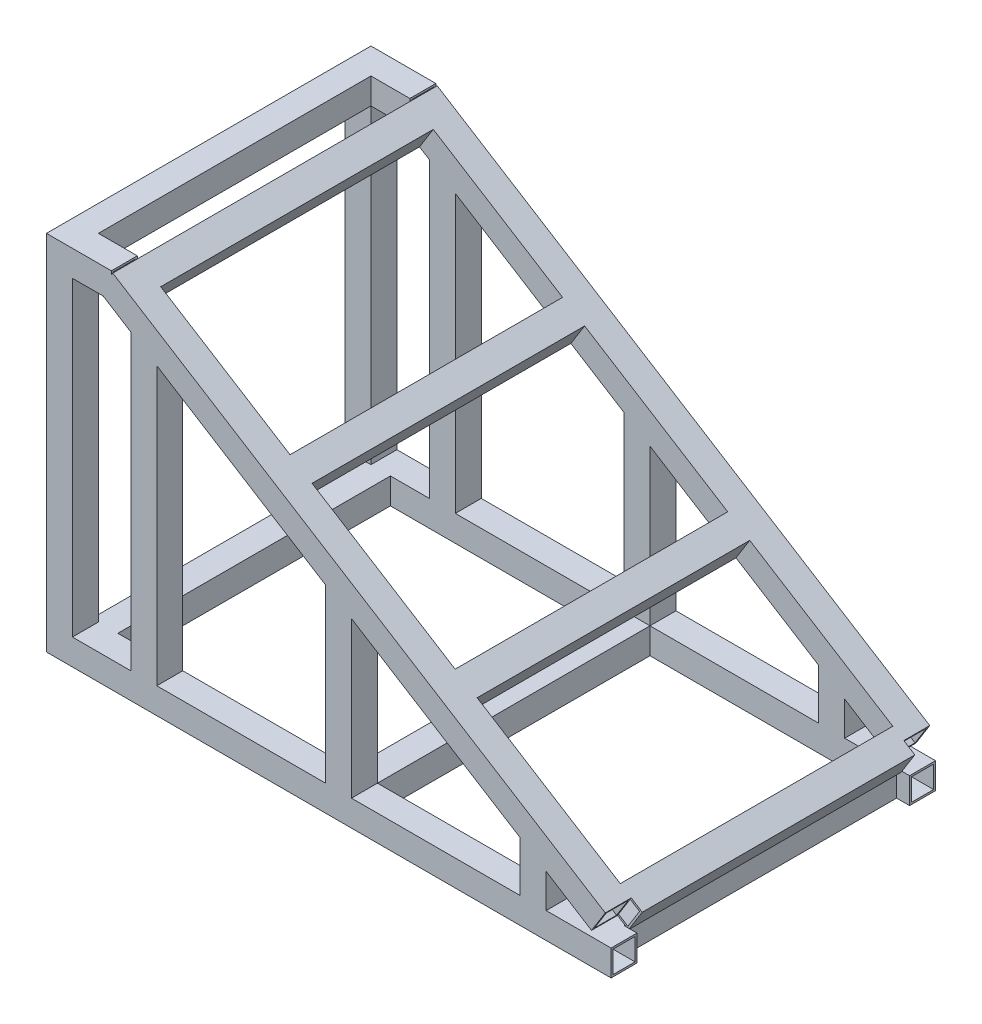
from build123d import *

# Parameters (mm, degrees)
SKETCH_1_W                      = 870
SKETCH_1_H                      = 40
L_BASE_870_SKIN_A_DEPTH         = 3
L_BASE_870_EDGE_WALLS_START     = 3
SKETCH_2_W                      = 870
SKETCH_2_H                      = 3
L_BASE_870_EDGE_WALLS_DEPTH     = 34
L_BASE_870_SKIN_B_START         = 37
SKETCH_3_W                      = 870
SKETCH_3_H                      = 40
L_BASE_870_SKIN_B_DEPTH         = 3
L_INCLINED_895_SKIN_A_DEPTH     = 3
L_INCLINED_895_EDGE_WALLS_START = 3
L_INCLINED_895_EDGE_WALLS_DEPTH = 34
L_INCLINED_895_SKIN_B_START     = 37
L_INCLINED_895_SKIN_B_DEPTH     = 3
SKETCH_7_W                      = 100
SKETCH_7_H                      = 40
L_PLATFORM_100_SKIN_A_DEPTH     = 3
L_PLATFORM_100_EDGE_WALLS_START = 3
SKETCH_8_W                      = 100
SKETCH_8_H                      = 3
L_PLATFORM_100_EDGE_WALLS_DEPTH = 34
L_PLATFORM_100_SKIN_B_START     = 37
SKETCH_9_W                      = 100
SKETCH_9_H                      = 40
L_PLATFORM_100_SKIN_B_DEPTH     = 3
SKETCH_10_W                     = 40
SKETCH_10_H                     = 478.752128099
L_REAR_POST_SKIN_A_DEPTH        = 3
L_REAR_POST_WALLS_START         = 3
SKETCH_11_W                     = 3
SKETCH_11_H                     = 478.752128099
L_REAR_POST_WALLS_DEPTH         = 34
L_REAR_POST_SKIN_B_START        = 37
SKETCH_12_W                     = 40
SKETCH_12_H                     = 478.752128099
L_REAR_POST_SKIN_B_DEPTH        = 3
L_POST_X200_SKIN_A_DEPTH        = 3
L_POST_X200_WALLS_START         = 3
L_POST_X200_WALLS_DEPTH         = 34
L_POST_X200_SKIN_B_START        = 37
L_POST_X200_SKIN_B_DEPTH        = 3
L_POST_X500_SKIN_A_DEPTH        = 3
L_POST_X500_WALLS_START         = 3
L_POST_X500_WALLS_DEPTH         = 34
L_POST_X500_SKIN_B_START        = 37
L_POST_X500_SKIN_B_DEPTH        = 3
L_POST_X800_SKIN_A_DEPTH        = 3
L_POST_X800_WALLS_START         = 3
L_POST_X800_WALLS_DEPTH         = 34
L_POST_X800_SKIN_B_START        = 37
L_POST_X800_SKIN_B_DEPTH        = 3
R_BASE_870_SKIN_A_START         = 460
SKETCH_22_W                     = 870
SKETCH_22_H                     = 40
R_BASE_870_SKIN_A_DEPTH         = 3
R_BASE_870_EDGE_WALLS_START     = 463
SKETCH_23_W                     = 870
SKETCH_23_H                     = 3
R_BASE_870_EDGE_WALLS_DEPTH     = 34
R_BASE_870_SKIN_B_START         = 497
SKETCH_24_W                     = 870
SKETCH_24_H                     = 40
R_BASE_870_SKIN_B_DEPTH         = 3
R_INCLINED_895_SKIN_A_START     = 460
R_INCLINED_895_SKIN_A_DEPTH     = 3
R_INCLINED_895_EDGE_WALLS_START = 463
R_INCLINED_895_EDGE_WALLS_DEPTH = 34
R_INCLINED_895_SKIN_B_START     = 497
R_INCLINED_895_SKIN_B_DEPTH     = 3
R_PLATFORM_100_SKIN_A_START     = 460
SKETCH_28_W                     = 100
SKETCH_28_H                     = 40
R_PLATFORM_100_SKIN_A_DEPTH     = 3
R_PLATFORM_100_EDGE_WALLS_START = 463
SKETCH_29_W                     = 100
SKETCH_29_H                     = 3
R_PLATFORM_100_EDGE_WALLS_DEPTH = 34
R_PLATFORM_100_SKIN_B_START     = 497
SKETCH_30_W                     = 100
SKETCH_30_H                     = 40
R_PLATFORM_100_SKIN_B_DEPTH     = 3
R_REAR_POST_SKIN_A_START        = 460
SKETCH_31_W                     = 40
SKETCH_31_H                     = 478.752128099
R_REAR_POST_SKIN_A_DEPTH        = 3
R_REAR_POST_WALLS_START         = 463
SKETCH_32_W                     = 3
SKETCH_32_H                     = 478.752128099
R_REAR_POST_WALLS_DEPTH         = 34
R_REAR_POST_SKIN_B_START        = 497
SKETCH_33_W                     = 40
SKETCH_33_H                     = 478.752128099
R_REAR_POST_SKIN_B_DEPTH        = 3
R_POST_X200_SKIN_A_START        = 460
R_POST_X200_SKIN_A_DEPTH        = 3
R_POST_X200_WALLS_START         = 463
R_POST_X200_WALLS_DEPTH         = 34
R_POST_X200_SKIN_B_START        = 497
R_POST_X200_SKIN_B_DEPTH        = 3
R_POST_X500_SKIN_A_START        = 460
R_POST_X500_SKIN_A_DEPTH        = 3
R_POST_X500_WALLS_START         = 463
R_POST_X500_WALLS_DEPTH         = 34
R_POST_X500_SKIN_B_START        = 497
R_POST_X500_SKIN_B_DEPTH        = 3
R_POST_X800_SKIN_A_START        = 460
R_POST_X800_SKIN_A_DEPTH        = 3
R_POST_X800_WALLS_START         = 463
R_POST_X800_WALLS_DEPTH         = 34
R_POST_X800_SKIN_B_START        = 497
R_POST_X800_SKIN_B_DEPTH        = 3
TRANSVERSE_S25_420_START        = 40
TRANSVERSE_S25_420_DEPTH        = 420
TRANSVERSE_S300_420_START       = 40
TRANSVERSE_S300_420_DEPTH       = 420
TRANSVERSE_S600_420_START       = 40
TRANSVERSE_S600_420_DEPTH       = 420
TRANSVERSE_S900_420_START       = 40
TRANSVERSE_S900_420_DEPTH       = 420
BASE_TRANSVERSE_X100_420_START  = 40
SKETCH_47_W                     = 40
SKETCH_47_H                     = 40
SKETCH_47_W_2                   = 34
SKETCH_47_H_2                   = 34
BASE_TRANSVERSE_X100_420_DEPTH  = 420
BASE_TRANSVERSE_X500_420_START  = 40
SKETCH_48_W                     = 40
SKETCH_48_H                     = 40
SKETCH_48_W_2                   = 34
SKETCH_48_H_2                   = 34
BASE_TRANSVERSE_X500_420_DEPTH  = 420
BASE_TRANSVERSE_X880_420_START  = 40
SKETCH_49_W                     = 40
SKETCH_49_H                     = 40
SKETCH_49_W_2                   = 34
SKETCH_49_H_2                   = 34
BASE_TRANSVERSE_X880_420_DEPTH  = 420
PLATFORM_CROSS_TIE_420_START    = 40
SKETCH_50_W                     = 40
SKETCH_50_H                     = 40
SKETCH_50_W_2                   = 34
SKETCH_50_H_2                   = 34
PLATFORM_CROSS_TIE_420_DEPTH    = 420


with BuildPart() as part:
    # 草图1 → L_base_870_skin_A (new body)
    with BuildSketch(Plane.XY):
        with Locations((485, 20)):
            Rectangle(SKETCH_1_W, SKETCH_1_H)
    extrude(amount=L_BASE_870_SKIN_A_DEPTH)

    # 草图2 → L_base_870_edge_walls (add)
    with BuildSketch(Plane.XY.offset(L_BASE_870_EDGE_WALLS_START)):
        with Locations((485, 1.5)):
            Rectangle(SKETCH_2_W, SKETCH_2_H)
        with Locations((485, 38.5)):
            Rectangle(SKETCH_2_W, SKETCH_2_H)
    extrude(amount=L_BASE_870_EDGE_WALLS_DEPTH)

    # 草图3 → L_base_870_skin_B (add)
    with BuildSketch(Plane.XY.offset(L_BASE_870_SKIN_B_START)):
        with Locations((485, 20)):
            Rectangle(SKETCH_3_W, SKETCH_3_H)
    extrude(amount=L_BASE_870_SKIN_B_DEPTH)



with BuildPart() as body_2:
    # 草图4 → L_inclined_895_skin_A (new body)
    with BuildSketch(Plane.XY):
        Polygon((130.923792855, 522.788415547), (889.926838915, 48.510674058), (911.123609484, 82.432597904), (152.120563424, 556.710339393), align=None)
    extrude(amount=L_INCLINED_895_SKIN_A_DEPTH)

    # 草图5 → L_inclined_895_edge_walls (add)
    with BuildSketch(Plane.XY.offset(L_INCLINED_895_EDGE_WALLS_START)):
        Polygon((130.923792855, 522.788415547), (889.926838915, 48.510674058), (891.516596707, 51.054818346), (132.513550647, 525.332559835), align=None)
        Polygon((150.530805631, 554.166195104), (909.533851691, 79.888453616), (911.123609484, 82.432597904), (152.120563424, 556.710339393), align=None)
    extrude(amount=L_INCLINED_895_EDGE_WALLS_DEPTH)

    # 草图6 → L_inclined_895_skin_B (add)
    with BuildSketch(Plane.XY.offset(L_INCLINED_895_SKIN_B_START)):
        Polygon((130.923792855, 522.788415547), (889.926838915, 48.510674058), (911.123609484, 82.432597904), (152.120563424, 556.710339393), align=None)
    extrude(amount=L_INCLINED_895_SKIN_B_DEPTH)

    # 草图7 → L_platform_100_skin_A (add)
    with BuildSketch(Plane.XY):
        with Locations((100, 538.752128099)):
            Rectangle(SKETCH_7_W, SKETCH_7_H)
    extrude(amount=L_PLATFORM_100_SKIN_A_DEPTH)

    # 草图8 → L_platform_100_edge_walls (add)
    with BuildSketch(Plane.XY.offset(L_PLATFORM_100_EDGE_WALLS_START)):
        with Locations((100, 520.252128099)):
            Rectangle(SKETCH_8_W, SKETCH_8_H)
        with Locations((100, 557.252128099)):
            Rectangle(SKETCH_8_W, SKETCH_8_H)
    extrude(amount=L_PLATFORM_100_EDGE_WALLS_DEPTH)

    # 草图9 → L_platform_100_skin_B (add)
    with BuildSketch(Plane.XY.offset(L_PLATFORM_100_SKIN_B_START)):
        with Locations((100, 538.752128099)):
            Rectangle(SKETCH_9_W, SKETCH_9_H)
    extrude(amount=L_PLATFORM_100_SKIN_B_DEPTH)


with BuildPart() as part_1:
    add(part.part)

    add(body_2.part)  # L_rear_post_skin_A merges body 2
    # 草图10 → L_rear_post_skin_A (add)
    with BuildSketch(Plane.XY):
        with Locations((70, 279.37606405)):
            Rectangle(SKETCH_10_W, SKETCH_10_H)
    extrude(amount=L_REAR_POST_SKIN_A_DEPTH)

    # 草图11 → L_rear_post_walls (add)
    with BuildSketch(Plane.XY.offset(L_REAR_POST_WALLS_START)):
        with Locations((51.5, 279.37606405)):
            Rectangle(SKETCH_11_W, SKETCH_11_H)
        with Locations((88.5, 279.37606405)):
            Rectangle(SKETCH_11_W, SKETCH_11_H)
    extrude(amount=L_REAR_POST_WALLS_DEPTH)

    # 草图12 → L_rear_post_skin_B (add)
    with BuildSketch(Plane.XY.offset(L_REAR_POST_SKIN_B_START)):
        with Locations((70, 279.37606405)):
            Rectangle(SKETCH_12_W, SKETCH_12_H)
    extrude(amount=L_REAR_POST_SKIN_B_DEPTH)

    # 草图13 → L_post_x200_skin_A (add)
    with BuildSketch(Plane.XY):
        Polygon((180, 40), (220, 40), (220, 467.127423717), (180, 492.122197794), align=None)
    extrude(amount=L_POST_X200_SKIN_A_DEPTH)

    # 草图14 → L_post_x200_walls (add)
    with BuildSketch(Plane.XY.offset(L_POST_X200_WALLS_START)):
        Polygon((180, 40), (183, 40), (183, 490.247589738), (180, 492.122197794), align=None)
        Polygon((217, 40), (220, 40), (220, 467.127423717), (217, 469.002031773), align=None)
    extrude(amount=L_POST_X200_WALLS_DEPTH)

    # 草图15 → L_post_x200_skin_B (add)
    with BuildSketch(Plane.XY.offset(L_POST_X200_SKIN_B_START)):
        Polygon((180, 40), (220, 40), (220, 467.127423717), (180, 492.122197794), align=None)
    extrude(amount=L_POST_X200_SKIN_B_DEPTH)

    # 草图16 → L_post_x500_skin_A (add)
    with BuildSketch(Plane.XY):
        Polygon((480, 40), (520, 40), (520, 279.666618144), (480, 304.661392221), align=None)
    extrude(amount=L_POST_X500_SKIN_A_DEPTH)

    # 草图17 → L_post_x500_walls (add)
    with BuildSketch(Plane.XY.offset(L_POST_X500_WALLS_START)):
        Polygon((480, 40), (483, 40), (483, 302.786784165), (480, 304.661392221), align=None)
        Polygon((517, 40), (520, 40), (520, 279.666618144), (517, 281.5412262), align=None)
    extrude(amount=L_POST_X500_WALLS_DEPTH)

    # 草图18 → L_post_x500_skin_B (add)
    with BuildSketch(Plane.XY.offset(L_POST_X500_SKIN_B_START)):
        Polygon((480, 40), (520, 40), (520, 279.666618144), (480, 304.661392221), align=None)
    extrude(amount=L_POST_X500_SKIN_B_DEPTH)

    # 草图19 → L_post_x800_skin_A (add)
    with BuildSketch(Plane.XY):
        Polygon((780, 40), (820, 40), (820, 92.205812572), (780, 117.200586648), align=None)
    extrude(amount=L_POST_X800_SKIN_A_DEPTH)

    # 草图20 → L_post_x800_walls (add)
    with BuildSketch(Plane.XY.offset(L_POST_X800_WALLS_START)):
        Polygon((780, 40), (783, 40), (783, 115.325978592), (780, 117.200586648), align=None)
        Polygon((817, 40), (820, 40), (820, 92.205812572), (817, 94.080420627), align=None)
    extrude(amount=L_POST_X800_WALLS_DEPTH)

    # 草图21 → L_post_x800_skin_B (add)
    with BuildSketch(Plane.XY.offset(L_POST_X800_SKIN_B_START)):
        Polygon((780, 40), (820, 40), (820, 92.205812572), (780, 117.200586648), align=None)
    extrude(amount=L_POST_X800_SKIN_B_DEPTH)



with BuildPart() as body_2_2:
    # 草图22 → R_base_870_skin_A (new body)
    with BuildSketch(Plane.XY.offset(R_BASE_870_SKIN_A_START)):
        with Locations((485, 20)):
            Rectangle(SKETCH_22_W, SKETCH_22_H)
    extrude(amount=R_BASE_870_SKIN_A_DEPTH)

    # 草图23 → R_base_870_edge_walls (add)
    with BuildSketch(Plane.XY.offset(R_BASE_870_EDGE_WALLS_START)):
        with Locations((485, 1.5)):
            Rectangle(SKETCH_23_W, SKETCH_23_H)
        with Locations((485, 38.5)):
            Rectangle(SKETCH_23_W, SKETCH_23_H)
    extrude(amount=R_BASE_870_EDGE_WALLS_DEPTH)

    # 草图24 → R_base_870_skin_B (add)
    with BuildSketch(Plane.XY.offset(R_BASE_870_SKIN_B_START)):
        with Locations((485, 20)):
            Rectangle(SKETCH_24_W, SKETCH_24_H)
    extrude(amount=R_BASE_870_SKIN_B_DEPTH)



with BuildPart() as body_3:
    # 草图25 → R_inclined_895_skin_A (new body)
    with BuildSketch(Plane.XY.offset(R_INCLINED_895_SKIN_A_START)):
        Polygon((130.923792855, 522.788415547), (889.926838915, 48.510674058), (911.123609484, 82.432597904), (152.120563424, 556.710339393), align=None)
    extrude(amount=R_INCLINED_895_SKIN_A_DEPTH)

    # 草图26 → R_inclined_895_edge_walls (add)
    with BuildSketch(Plane.XY.offset(R_INCLINED_895_EDGE_WALLS_START)):
        Polygon((130.923792855, 522.788415547), (889.926838915, 48.510674058), (891.516596707, 51.054818346), (132.513550647, 525.332559835), align=None)
        Polygon((150.530805631, 554.166195104), (909.533851691, 79.888453616), (911.123609484, 82.432597904), (152.120563424, 556.710339393), align=None)
    extrude(amount=R_INCLINED_895_EDGE_WALLS_DEPTH)

    # 草图27 → R_inclined_895_skin_B (add)
    with BuildSketch(Plane.XY.offset(R_INCLINED_895_SKIN_B_START)):
        Polygon((130.923792855, 522.788415547), (889.926838915, 48.510674058), (911.123609484, 82.432597904), (152.120563424, 556.710339393), align=None)
    extrude(amount=R_INCLINED_895_SKIN_B_DEPTH)

    # 草图28 → R_platform_100_skin_A (add)
    with BuildSketch(Plane.XY.offset(R_PLATFORM_100_SKIN_A_START)):
        with Locations((100, 538.752128099)):
            Rectangle(SKETCH_28_W, SKETCH_28_H)
    extrude(amount=R_PLATFORM_100_SKIN_A_DEPTH)

    # 草图29 → R_platform_100_edge_walls (add)
    with BuildSketch(Plane.XY.offset(R_PLATFORM_100_EDGE_WALLS_START)):
        with Locations((100, 520.252128099)):
            Rectangle(SKETCH_29_W, SKETCH_29_H)
        with Locations((100, 557.252128099)):
            Rectangle(SKETCH_29_W, SKETCH_29_H)
    extrude(amount=R_PLATFORM_100_EDGE_WALLS_DEPTH)

    # 草图30 → R_platform_100_skin_B (add)
    with BuildSketch(Plane.XY.offset(R_PLATFORM_100_SKIN_B_START)):
        with Locations((100, 538.752128099)):
            Rectangle(SKETCH_30_W, SKETCH_30_H)
    extrude(amount=R_PLATFORM_100_SKIN_B_DEPTH)


with BuildPart() as body_2_2_1:
    add(body_2_2.part)

    add(body_3.part)  # R_rear_post_skin_A merges body 3
    # 草图31 → R_rear_post_skin_A (add)
    with BuildSketch(Plane.XY.offset(R_REAR_POST_SKIN_A_START)):
        with Locations((70, 279.37606405)):
            Rectangle(SKETCH_31_W, SKETCH_31_H)
    extrude(amount=R_REAR_POST_SKIN_A_DEPTH)

    # 草图32 → R_rear_post_walls (add)
    with BuildSketch(Plane.XY.offset(R_REAR_POST_WALLS_START)):
        with Locations((51.5, 279.37606405)):
            Rectangle(SKETCH_32_W, SKETCH_32_H)
        with Locations((88.5, 279.37606405)):
            Rectangle(SKETCH_32_W, SKETCH_32_H)
    extrude(amount=R_REAR_POST_WALLS_DEPTH)

    # 草图33 → R_rear_post_skin_B (add)
    with BuildSketch(Plane.XY.offset(R_REAR_POST_SKIN_B_START)):
        with Locations((70, 279.37606405)):
            Rectangle(SKETCH_33_W, SKETCH_33_H)
    extrude(amount=R_REAR_POST_SKIN_B_DEPTH)

    # 草图34 → R_post_x200_skin_A (add)
    with BuildSketch(Plane.XY.offset(R_POST_X200_SKIN_A_START)):
        Polygon((180, 40), (220, 40), (220, 467.127423717), (180, 492.122197794), align=None)
    extrude(amount=R_POST_X200_SKIN_A_DEPTH)

    # 草图35 → R_post_x200_walls (add)
    with BuildSketch(Plane.XY.offset(R_POST_X200_WALLS_START)):
        Polygon((180, 40), (183, 40), (183, 490.247589738), (180, 492.122197794), align=None)
        Polygon((217, 40), (220, 40), (220, 467.127423717), (217, 469.002031773), align=None)
    extrude(amount=R_POST_X200_WALLS_DEPTH)

    # 草图36 → R_post_x200_skin_B (add)
    with BuildSketch(Plane.XY.offset(R_POST_X200_SKIN_B_START)):
        Polygon((180, 40), (220, 40), (220, 467.127423717), (180, 492.122197794), align=None)
    extrude(amount=R_POST_X200_SKIN_B_DEPTH)

    # 草图37 → R_post_x500_skin_A (add)
    with BuildSketch(Plane.XY.offset(R_POST_X500_SKIN_A_START)):
        Polygon((480, 40), (520, 40), (520, 279.666618144), (480, 304.661392221), align=None)
    extrude(amount=R_POST_X500_SKIN_A_DEPTH)

    # 草图38 → R_post_x500_walls (add)
    with BuildSketch(Plane.XY.offset(R_POST_X500_WALLS_START)):
        Polygon((480, 40), (483, 40), (483, 302.786784165), (480, 304.661392221), align=None)
        Polygon((517, 40), (520, 40), (520, 279.666618144), (517, 281.5412262), align=None)
    extrude(amount=R_POST_X500_WALLS_DEPTH)

    # 草图39 → R_post_x500_skin_B (add)
    with BuildSketch(Plane.XY.offset(R_POST_X500_SKIN_B_START)):
        Polygon((480, 40), (520, 40), (520, 279.666618144), (480, 304.661392221), align=None)
    extrude(amount=R_POST_X500_SKIN_B_DEPTH)

    # 草图40 → R_post_x800_skin_A (add)
    with BuildSketch(Plane.XY.offset(R_POST_X800_SKIN_A_START)):
        Polygon((780, 40), (820, 40), (820, 92.205812572), (780, 117.200586648), align=None)
    extrude(amount=R_POST_X800_SKIN_A_DEPTH)

    # 草图41 → R_post_x800_walls (add)
    with BuildSketch(Plane.XY.offset(R_POST_X800_WALLS_START)):
        Polygon((780, 40), (783, 40), (783, 115.325978592), (780, 117.200586648), align=None)
        Polygon((817, 40), (820, 40), (820, 92.205812572), (817, 94.080420627), align=None)
    extrude(amount=R_POST_X800_WALLS_DEPTH)

    # 草图42 → R_post_x800_skin_B (add)
    with BuildSketch(Plane.XY.offset(R_POST_X800_SKIN_B_START)):
        Polygon((780, 40), (820, 40), (820, 92.205812572), (780, 117.200586648), align=None)
    extrude(amount=R_POST_X800_SKIN_B_DEPTH)


with BuildPart() as part_2:
    add(part_1.part)

    add(body_2_2_1.part)  # Transverse_s25_420 merges body 2 2
    # 草图43 → Transverse_s25_420 (add)
    with BuildSketch(Plane.XY.offset(TRANSVERSE_S25_420_START)):
        Polygon((130.923792855, 522.788415547), (164.845716701, 501.591644977), (186.04248727, 535.513568824), (152.120563424, 556.710339393), align=None)
        Polygon((135.057694936, 523.742802042), (163.891330205, 505.725547059), (181.908585189, 534.559182328), (153.07494992, 552.576437312), align=None, mode=Mode.SUBTRACT)
    extrude(amount=TRANSVERSE_S25_420_DEPTH)

    # 草图44 → Transverse_s300_420 (add)
    with BuildSketch(Plane.XY.offset(TRANSVERSE_S300_420_START)):
        Polygon((364.137019298, 377.060617883), (398.058943144, 355.863847313), (419.255713713, 389.785771159), (385.333789867, 410.982541729), align=None)
        Polygon((368.270921379, 378.015004378), (397.104556648, 359.997749394), (415.121811632, 388.831384664), (386.288176363, 406.848639648), align=None, mode=Mode.SUBTRACT)
    extrude(amount=TRANSVERSE_S300_420_DEPTH)

    # 草图45 → Transverse_s600_420 (add)
    with BuildSketch(Plane.XY.offset(TRANSVERSE_S600_420_START)):
        Polygon((618.551448144, 218.084838613), (652.473371991, 196.888068043), (673.67014256, 230.80999189), (639.748218714, 252.006762459), align=None)
        Polygon((622.685350226, 219.039225108), (651.518985495, 201.021970124), (669.536240479, 229.855605394), (640.70260521, 247.872860378), align=None, mode=Mode.SUBTRACT)
    extrude(amount=TRANSVERSE_S600_420_DEPTH)

    # 草图46 → Transverse_s900_420 (add)
    with BuildSketch(Plane.XY.offset(TRANSVERSE_S900_420_START)):
        Polygon((872.965876991, 59.109059343), (906.887800838, 37.912288773), (928.084571407, 71.83421262), (894.162647561, 93.030983189), align=None)
        Polygon((877.099779073, 60.063445838), (905.933414342, 42.046190854), (923.950669326, 70.879826124), (895.117034056, 88.897081108), align=None, mode=Mode.SUBTRACT)
    extrude(amount=TRANSVERSE_S900_420_DEPTH)

    # 草图47 → Base_transverse_x100_420 (add)
    with BuildSketch(Plane.XY.offset(BASE_TRANSVERSE_X100_420_START)):
        with Locations((100, 20)):
            Rectangle(SKETCH_47_W, SKETCH_47_H)
        with Locations((100, 20)):
            Rectangle(SKETCH_47_W_2, SKETCH_47_H_2, mode=Mode.SUBTRACT)
    extrude(amount=BASE_TRANSVERSE_X100_420_DEPTH)

    # 草图48 → Base_transverse_x500_420 (add)
    with BuildSketch(Plane.XY.offset(BASE_TRANSVERSE_X500_420_START)):
        with Locations((500, 20)):
            Rectangle(SKETCH_48_W, SKETCH_48_H)
        with Locations((500, 20)):
            Rectangle(SKETCH_48_W_2, SKETCH_48_H_2, mode=Mode.SUBTRACT)
    extrude(amount=BASE_TRANSVERSE_X500_420_DEPTH)

    # 草图49 → Base_transverse_x880_420 (add)
    with BuildSketch(Plane.XY.offset(BASE_TRANSVERSE_X880_420_START)):
        with Locations((880, 20)):
            Rectangle(SKETCH_49_W, SKETCH_49_H)
        with Locations((880, 20)):
            Rectangle(SKETCH_49_W_2, SKETCH_49_H_2, mode=Mode.SUBTRACT)
    extrude(amount=BASE_TRANSVERSE_X880_420_DEPTH)

    # 草图50 → Platform_cross_tie_420 (add)
    with BuildSketch(Plane.XY.offset(PLATFORM_CROSS_TIE_420_START)):
        with Locations((70, 538.752128099)):
            Rectangle(SKETCH_50_W, SKETCH_50_H)
        with Locations((70, 538.752128099)):
            Rectangle(SKETCH_50_W_2, SKETCH_50_H_2, mode=Mode.SUBTRACT)
    extrude(amount=PLATFORM_CROSS_TIE_420_DEPTH)


solid = part_2.part
